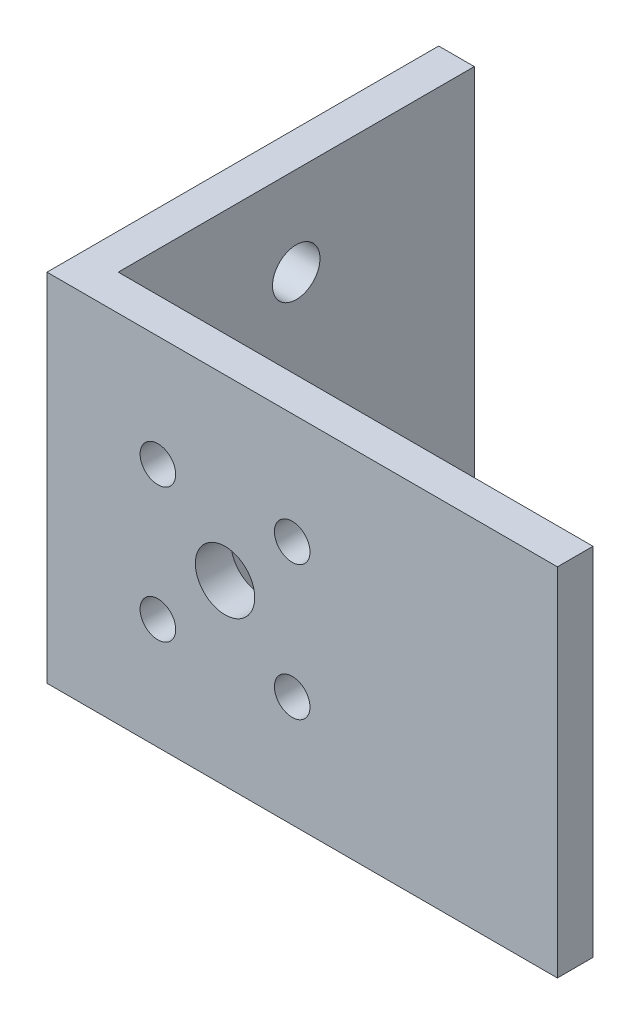
from build123d import *

# Parameters (mm, degrees)
EXTRUDE_1_DEPTH     = 30
CUT_EXTRUDE_1_REACH = 63.952
SKETCH_4_R          = 2
CUT_EXTRUDE_2_REACH = 62.407
SKETCH_5_R          = 2.5
SKETCH_5_R_2        = 1.5


with BuildPart() as part:
    # 草图2 → 凸台-拉伸1 (new body)
    with BuildSketch(Plane(origin=(0, 0, 0), x_dir=(1, 0, 0), z_dir=(0, 1, 0))):
        Polygon((0, 0), (43, 0), (43, 3), (3, 3), (3, 33), (0, 33), align=None)
    extrude(amount=EXTRUDE_1_DEPTH)

    # 草图4 → 切除-拉伸1 (cut, up to next)
    with BuildSketch(Plane.ZY, mode=Mode.PRIVATE) as cut_extrude_1_sk1:
        with Locations((-18, 7.5)):
            Circle(SKETCH_4_R)
    cut_extrude_1_tool1 = extrude(cut_extrude_1_sk1.sketch, amount=-CUT_EXTRUDE_1_REACH, mode=Mode.PRIVATE) & part.part
    # 草图4 → 切除-拉伸1 (cut, up to next)
    with BuildSketch(Plane.ZY, mode=Mode.PRIVATE) as cut_extrude_1_sk2:
        with Locations((-18, 22.5)):
            Circle(SKETCH_4_R)
    cut_extrude_1_tool2 = extrude(cut_extrude_1_sk2.sketch, amount=-CUT_EXTRUDE_1_REACH, mode=Mode.PRIVATE) & part.part
    add(cut_extrude_1_tool1.solids().sort_by_distance((0, 7.5, -18))[0], mode=Mode.SUBTRACT)
    add(cut_extrude_1_tool2.solids().sort_by_distance((0, 22.5, -18))[0], mode=Mode.SUBTRACT)

    # 草图5 → 切除-拉伸2 (cut, up to next)
    with BuildSketch(Plane(origin=(0, 0, -3), x_dir=(-1, 0, 0), z_dir=(0, 0, -1)), mode=Mode.PRIVATE) as cut_extrude_2_sk1:
        with Locations((-15, 15)):
            Circle(SKETCH_5_R)
    cut_extrude_2_tool1 = extrude(cut_extrude_2_sk1.sketch, amount=-CUT_EXTRUDE_2_REACH, mode=Mode.PRIVATE) & part.part
    # 草图5 → 切除-拉伸2 (cut, up to next)
    with BuildSketch(Plane(origin=(0, 0, -3), x_dir=(-1, 0, 0), z_dir=(0, 0, -1)), mode=Mode.PRIVATE) as cut_extrude_2_sk2:
        with Locations((-20.656854249, 9.343145751)):
            Circle(SKETCH_5_R_2)
    cut_extrude_2_tool2 = extrude(cut_extrude_2_sk2.sketch, amount=-CUT_EXTRUDE_2_REACH, mode=Mode.PRIVATE) & part.part
    # 草图5 → 切除-拉伸2 (cut, up to next)
    with BuildSketch(Plane(origin=(0, 0, -3), x_dir=(-1, 0, 0), z_dir=(0, 0, -1)), mode=Mode.PRIVATE) as cut_extrude_2_sk3:
        with Locations((-9.343145751, 9.343145751)):
            Circle(SKETCH_5_R_2)
    cut_extrude_2_tool3 = extrude(cut_extrude_2_sk3.sketch, amount=-CUT_EXTRUDE_2_REACH, mode=Mode.PRIVATE) & part.part
    # 草图5 → 切除-拉伸2 (cut, up to next)
    with BuildSketch(Plane(origin=(0, 0, -3), x_dir=(-1, 0, 0), z_dir=(0, 0, -1)), mode=Mode.PRIVATE) as cut_extrude_2_sk4:
        with Locations((-20.656854249, 20.656854249)):
            Circle(SKETCH_5_R_2)
    cut_extrude_2_tool4 = extrude(cut_extrude_2_sk4.sketch, amount=-CUT_EXTRUDE_2_REACH, mode=Mode.PRIVATE) & part.part
    # 草图5 → 切除-拉伸2 (cut, up to next)
    with BuildSketch(Plane(origin=(0, 0, -3), x_dir=(-1, 0, 0), z_dir=(0, 0, -1)), mode=Mode.PRIVATE) as cut_extrude_2_sk5:
        with Locations((-9.343145751, 20.656854249)):
            Circle(SKETCH_5_R_2)
    cut_extrude_2_tool5 = extrude(cut_extrude_2_sk5.sketch, amount=-CUT_EXTRUDE_2_REACH, mode=Mode.PRIVATE) & part.part
    add(cut_extrude_2_tool1.solids().sort_by_distance((15, 15, -3))[0], mode=Mode.SUBTRACT)
    add(cut_extrude_2_tool2.solids().sort_by_distance((20.656854, 9.343146, -3))[0], mode=Mode.SUBTRACT)
    add(cut_extrude_2_tool3.solids().sort_by_distance((9.343146, 9.343146, -3))[0], mode=Mode.SUBTRACT)
    add(cut_extrude_2_tool4.solids().sort_by_distance((20.656854, 20.656854, -3))[0], mode=Mode.SUBTRACT)
    add(cut_extrude_2_tool5.solids().sort_by_distance((9.343146, 20.656854, -3))[0], mode=Mode.SUBTRACT)


solid = part.part
